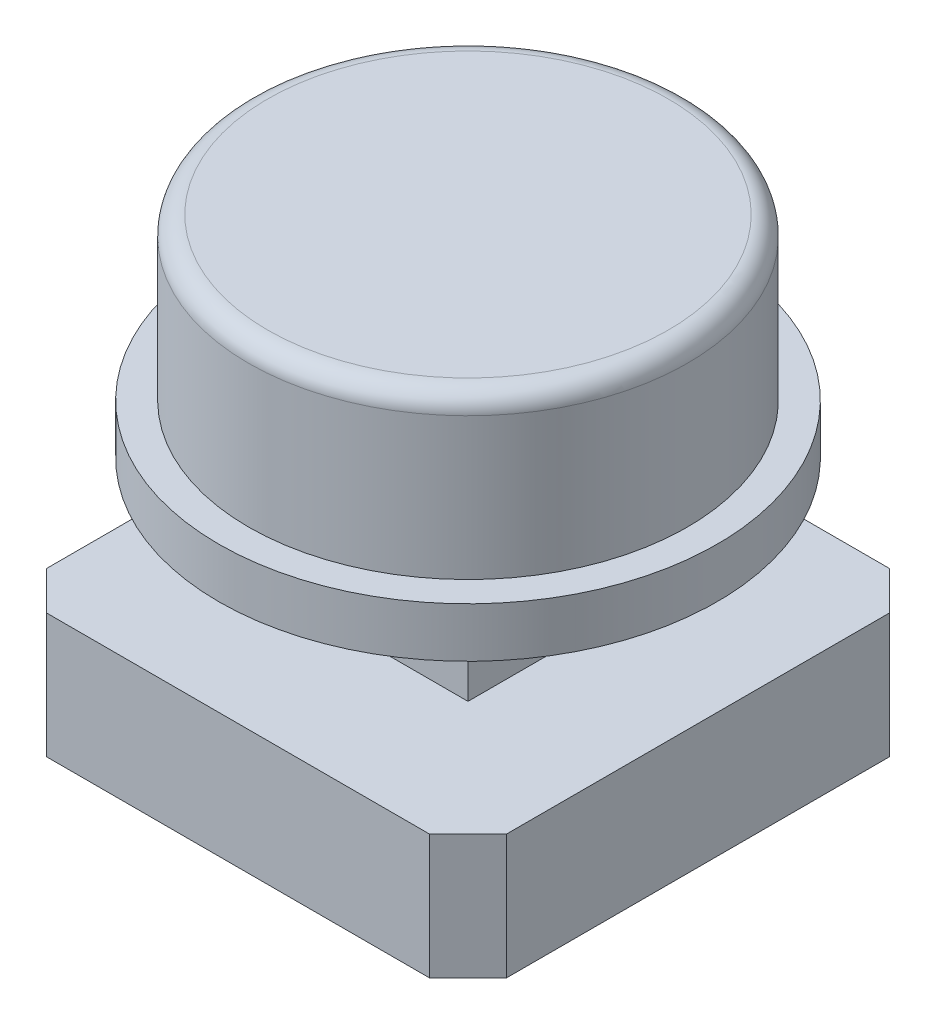
from build123d import *

# Parameters (mm, degrees)
SKETCH1_W           = 12
SKETCH1_H           = 12
BOSS_EXTRUDE1_DEPTH = 3.25
CHAMFER1_SIZE       = 1
SKETCH2_W           = 5
SKETCH2_H           = 5
BOSS_EXTRUDE2_DEPTH = 3
SKETCH3_R           = 6.5
BOSS_EXTRUDE3_DEPTH = 5.5
CUT_EXTRUDE1_START  = -4.2
SKETCH4_R           = 6.5
SKETCH4_R_2         = 5.725
CUT_EXTRUDE1_DEPTH  = 4.2
FILLET1_R           = 0.5


with BuildPart() as part:
    # Sketch1 → Boss-Extrude1 (new body)
    with BuildSketch(Plane(origin=(0, 0, 0), x_dir=(1, 0, 0), z_dir=(0, 1, 0))):
        Rectangle(SKETCH1_W, SKETCH1_H)
    extrude(amount=BOSS_EXTRUDE1_DEPTH)

    # Chamfer1
    chamfer1_edges = [part.edges().sort_by_distance(p)[0] for p in [
        (-6, 1.625, -6),
        (6, 1.625, -6),
        (6, 1.625, 6),
        (-6, 1.625, 6),
    ]]
    chamfer(chamfer1_edges, length=CHAMFER1_SIZE)

    # Sketch2 → Boss-Extrude2 (add)
    with BuildSketch(Plane(origin=(0, 3.25, 0), x_dir=(1, 0, 0), z_dir=(0, 1, 0))):
        Rectangle(SKETCH2_W, SKETCH2_H)
    extrude(amount=BOSS_EXTRUDE2_DEPTH)

    # Sketch3 → Boss-Extrude3 (add)
    with BuildSketch(Plane(origin=(0, 6.25, 0), x_dir=(1, 0, 0), z_dir=(0, 1, 0))):
        with Locations(Location((0, 0, 0), (0, 0, 270))):
            Circle(SKETCH3_R)
    extrude(amount=BOSS_EXTRUDE3_DEPTH)

    # Sketch4 → Cut-Extrude1 (cut)
    with BuildSketch(Plane(origin=(0, 11.75, 0), x_dir=(1, 0, 0), z_dir=(0, 1, 0)).offset(CUT_EXTRUDE1_START)):
        with Locations(Location((0, 0, 0), (0, 0, 270))):
            Circle(SKETCH4_R)
        with Locations(Location((0, 0, 0), (0, 0, 270))):
            Circle(SKETCH4_R_2, mode=Mode.SUBTRACT)
    extrude(amount=CUT_EXTRUDE1_DEPTH, mode=Mode.SUBTRACT)

    # Fillet1
    fillet1_edges = [part.edges().sort_by_distance(p)[0] for p in [
        (0, 11.75, -5.725),
    ]]
    fillet(fillet1_edges, radius=FILLET1_R)


solid = part.part
